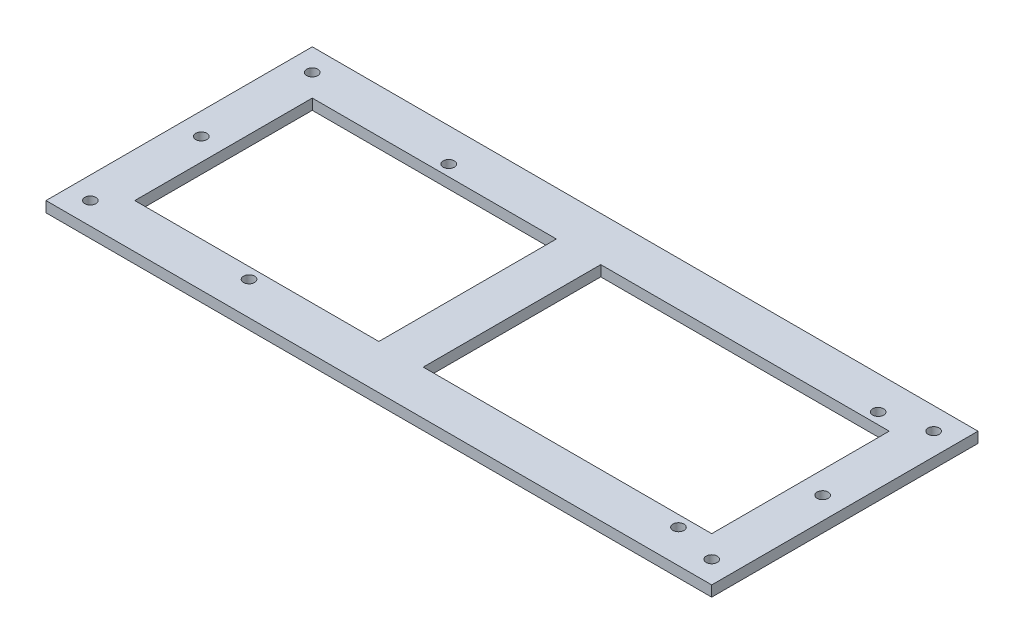
from build123d import *

# Parameters (mm, degrees)
SKETCH1_W           = 190.5
SKETCH1_H           = 76.2
BOSS_EXTRUDE1_DEPTH = 3.048
SKETCH2_W           = 82.55
SKETCH2_H           = 50.8
SKETCH2_W_2         = 69.85
CUT_EXTRUDE1_DEPTH  = 3.048
SKETCH3_R           = 1.5875
CUT_EXTRUDE2_DEPTH  = 3.048


with BuildPart() as part:
    # Sketch1 → Boss-Extrude1 (new body)
    with BuildSketch(Plane(origin=(0, 0, 0), x_dir=(1, 0, 0), z_dir=(0, 1, 0))):
        with Locations((-95.25, -38.1)):
            Rectangle(SKETCH1_W, SKETCH1_H)
    extrude(amount=BOSS_EXTRUDE1_DEPTH)

    # Sketch2 → Cut-Extrude1 (cut)
    with BuildSketch(Plane(origin=(0, 3.048, 0), x_dir=(1, 0, 0), z_dir=(0, 1, 0))):
        with Locations((-53.975, -38.1)):
            Rectangle(SKETCH2_W, SKETCH2_H)
        with Locations((-142.875, -38.1)):
            Rectangle(SKETCH2_W_2, SKETCH2_H)
    extrude(amount=-CUT_EXTRUDE1_DEPTH, mode=Mode.SUBTRACT)

    # Sketch3 → Cut-Extrude2 (cut)
    with BuildSketch(Plane(origin=(0, 3.048, 0), x_dir=(1, 0, 0), z_dir=(0, 1, 0))):
        with Locations(Location((-6.35, -38.1, 0), (0, 0, 270))):
            Circle(SKETCH3_R)
        with Locations(Location((-184.168238783, -38.1, 0), (0, 0, 270))):
            Circle(SKETCH3_R)
        with Locations(Location((-6.35, -6.35, 0), (0, 0, 270))):
            Circle(SKETCH3_R)
        with Locations(Location((-184.168238783, -6.35, 0), (0, 0, 270))):
            Circle(SKETCH3_R)
        with Locations(Location((-184.168238783, -69.85, 0), (0, 0, 270))):
            Circle(SKETCH3_R)
        with Locations(Location((-6.35, -69.85, 0), (0, 0, 270))):
            Circle(SKETCH3_R)
        with Locations(Location((-19.05, -9.525, 0), (0, 0, 270))):
            Circle(SKETCH3_R)
        with Locations(Location((-19.05, -66.675, 0), (0, 0, 270))):
            Circle(SKETCH3_R)
        with Locations(Location((-141.9225, -9.525, 0), (0, 0, 270))):
            Circle(SKETCH3_R)
        with Locations(Location((-141.9225, -66.675, 0), (0, 0, 270))):
            Circle(SKETCH3_R)
    extrude(amount=-CUT_EXTRUDE2_DEPTH, mode=Mode.SUBTRACT)


solid = part.part
